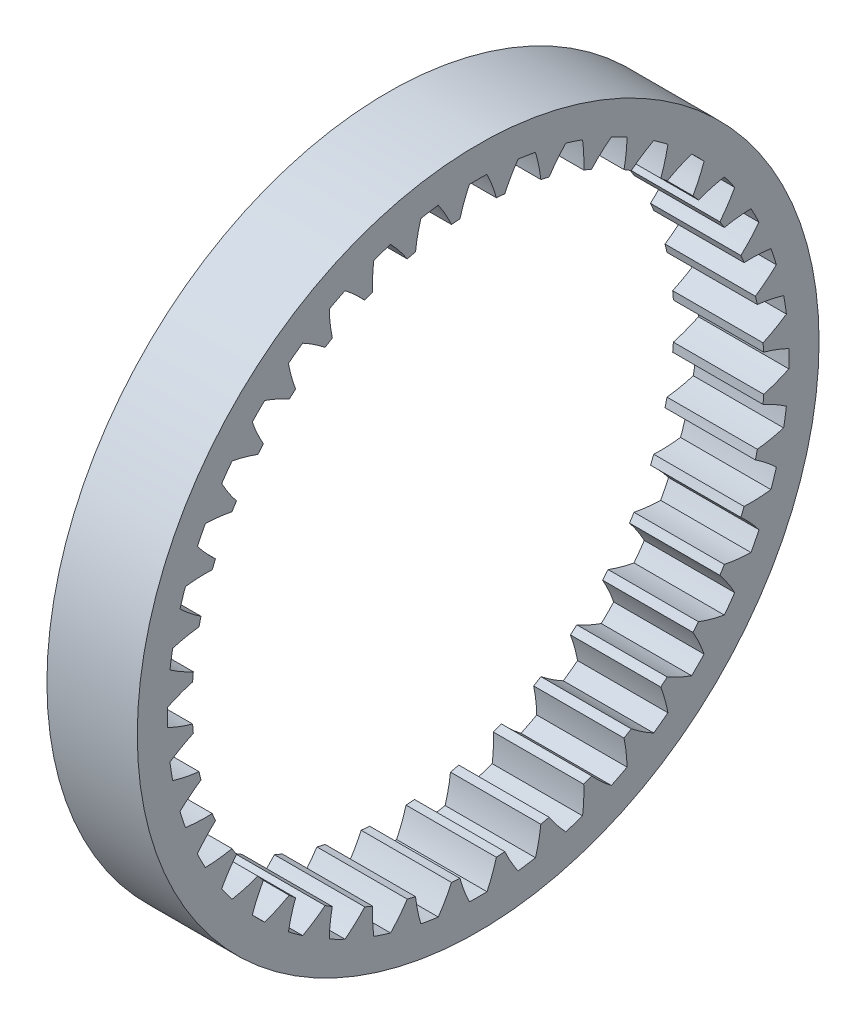
from build123d import *

# Parameters (mm, degrees)
BASPROSKE_W         = 12
BASPROSKE_H         = 4.5264
TOOTHCUT_DEPTH      = 62.326905954
TEETHCUTS_COUNT     = 40
TEETHCUTS_ANGLE     = 351
SKETCH1_R           = 45.2764
SKETCH1_R_2         = 41.2764
EXTRUDE_THIN1_DEPTH = 12
SCALE1_SCALE        = 0.4


with BuildPart() as part:
    # BasProSke → Base-Revolve (revolve)
    with BuildSketch(Plane(origin=(0, 0, 0), x_dir=(1, 0, 0), z_dir=(0, 1, 0)), mode=Mode.PRIVATE) as base_revolve_sk:
        with Locations((6, 40.2632)):
            Rectangle(BASPROSKE_W, BASPROSKE_H)
    revolve(base_revolve_sk.sketch.rotate(Axis((-10, 0, 0), (1, 0, 0)), 180), axis=Axis((-10, 0, 0), (1, 0, 0)))

    # TooCutSke → ToothCut (cut, through all)
    with BuildSketch(Plane(origin=(0, 0, 0), x_dir=(0, 0, -1), z_dir=(1, 0, 0))):
        with BuildLine():
            ThreePointArc((2.427265626, 37.896947459), (1.618641911, 40.256878641), (0.522524415, 42.497787816))
            ThreePointArc((0.522524415, 42.497787816), (0, 42.501), (-0.522524415, 42.497787816))
            ThreePointArc((-0.522524415, 42.497787816), (-1.618641911, 40.256878641), (-2.427265626, 37.896947459))
            ThreePointArc((-2.427265626, 37.896947459), (0, 37.9746), (2.427265626, 37.896947459))
        make_face()
    toothcut = extrude(amount=TOOTHCUT_DEPTH, mode=Mode.SUBTRACT)

    # TeethCuts: ToothCut ×40 about axis
    teethcuts_axis = Axis((-10, 0, 0), (1, 0, 0))
    for i in range(1, TEETHCUTS_COUNT):
        add(toothcut.rotate(teethcuts_axis, i * TEETHCUTS_ANGLE / (TEETHCUTS_COUNT - 1)), mode=Mode.SUBTRACT)

    # Sketch1 → Extrude-Thin1 (add, through all)
    with BuildSketch(Plane(origin=(0, 0, 0), x_dir=(0, 0, -1), z_dir=(1, 0, 0))):
        Circle(SKETCH1_R)
        Circle(SKETCH1_R_2, mode=Mode.SUBTRACT)
    extrude(amount=EXTRUDE_THIN1_DEPTH)


with BuildPart() as part_1:
    # Scale1: scaled about (0, 0, 0)
    add(part.part.scale(SCALE1_SCALE))


solid = part_1.part
